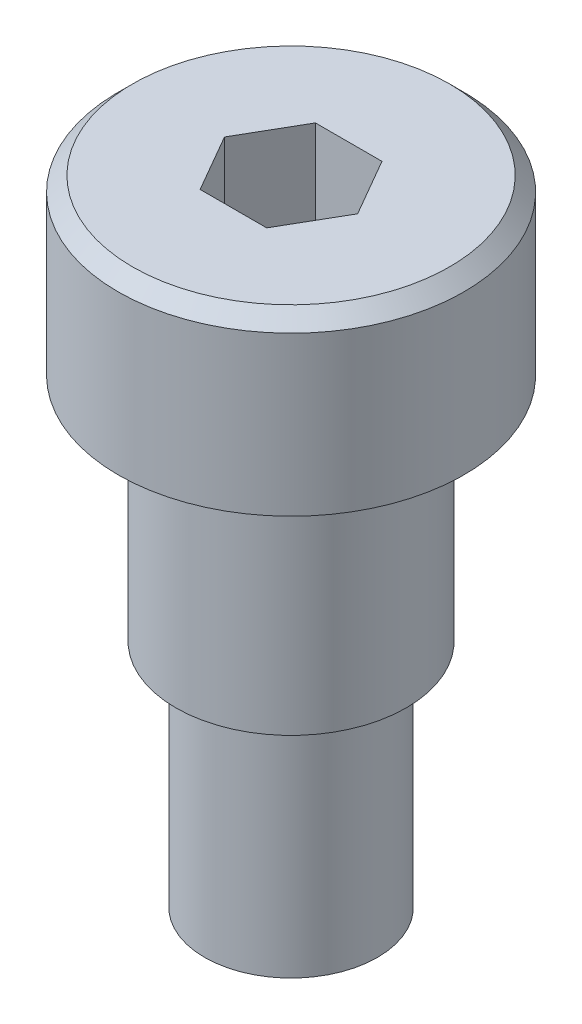
from build123d import *

# Parameters (mm, degrees)
SKETCH1_R           = 3
BOSS_EXTRUDE1_DEPTH = 3
SKETCH2_R           = 2
BOSS_EXTRUDE2_DEPTH = 4
SKETCH3_R           = 1.5
BOSS_EXTRUDE3_DEPTH = 4
CUT_EXTRUDE1_DEPTH  = 2
CHAMFER1_SIZE       = 0.25


with BuildPart() as part:
    # Sketch1 → Boss-Extrude1 (new body)
    with BuildSketch(Plane(origin=(0, 0, 0), x_dir=(1, 0, 0), z_dir=(0, 1, 0))):
        with Locations(Location((0, 0, 0), (0, 0, 270))):
            Circle(SKETCH1_R)
    extrude(amount=BOSS_EXTRUDE1_DEPTH)

    # Sketch2 → Boss-Extrude2 (add)
    with BuildSketch(Plane.XZ):
        with Locations(Location((0, 0, 0), (0, 0, 90))):
            Circle(SKETCH2_R)
    extrude(amount=BOSS_EXTRUDE2_DEPTH)

    # Sketch3 → Boss-Extrude3 (add)
    with BuildSketch(Plane.XZ.offset(4)):
        with Locations(Location((0, 0, 0), (0, 0, 270))):
            Circle(SKETCH3_R)
    extrude(amount=BOSS_EXTRUDE3_DEPTH)

    # Sketch4 → Cut-Extrude1 (cut)
    with BuildSketch(Plane(origin=(0, 3, 0), x_dir=(1, 0, 0), z_dir=(0, 1, 0))):
        Polygon((0.577350269, 1), (-0.577350269, 1), (-1.154700538, 0), (-0.577350269, -1), (0.577350269, -1), (1.154700538, 0), align=None)
    extrude(amount=-CUT_EXTRUDE1_DEPTH, mode=Mode.SUBTRACT)

    # Chamfer1
    chamfer1_edges = [part.edges().sort_by_distance(p)[0] for p in [
        (0, 3, -3),
    ]]
    chamfer(chamfer1_edges, length=CHAMFER1_SIZE)


solid = part.part
